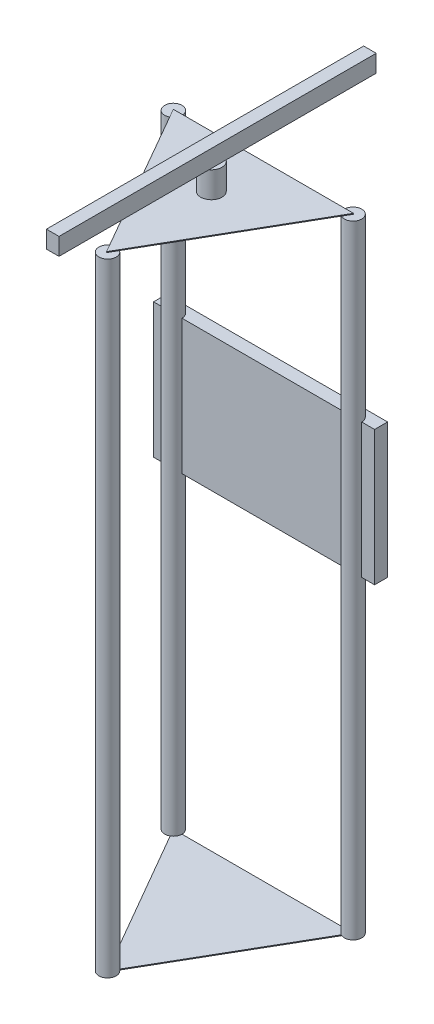
from build123d import *

# Parameters (mm, degrees)
BOSS_EXTRUDE1_DEPTH = 2.54
SKETCH2_R           = 25.4
BOSS_EXTRUDE2_DEPTH = 1828.8
BOSS_EXTRUDE3_DEPTH = 2.54
SKETCH4_R           = 31.109831221
BOSS_EXTRUDE5_DEPTH = 76.2
SKETCH5_W           = 36.901431936
SKETCH5_H           = 931.81733007
BOSS_EXTRUDE7_DEPTH = 50.8
BOSS_EXTRUDE8_DEPTH = 38.1


with BuildPart() as part:
    # Sketch1 → Boss-Extrude1 (new body)
    with BuildSketch(Plane(origin=(0, 0, 0), x_dir=(1, 0, 0), z_dir=(0, 1, 0))):
        Polygon((0, -304.8), (263.964543074, 152.4), (-263.964543074, 152.4), align=None)
    extrude(amount=BOSS_EXTRUDE1_DEPTH)

    # Sketch2 → Boss-Extrude2 (add)
    with BuildSketch(Plane(origin=(0, 2.54, 0), x_dir=(1, 0, 0), z_dir=(0, 1, 0))):
        with Locations(Location((0, -304.8, 0), (0, 0, 120))):
            Circle(SKETCH2_R)
        with Locations((-263.964543074, 152.4)):
            Circle(SKETCH2_R)
        with Locations(Location((263.964543074, 152.4, 0), (0, 0, 180))):
            Circle(SKETCH2_R)
    extrude(amount=BOSS_EXTRUDE2_DEPTH)

    # Sketch3 → Boss-Extrude3 (add)
    with BuildSketch(Plane(origin=(0, 1831.34, 0), x_dir=(1, 0, 0), z_dir=(0, 1, 0))):
        Polygon((-263.964543074, 152.4), (0, -307.726008903), (265.059219048, 152.4), align=None)
    extrude(amount=BOSS_EXTRUDE3_DEPTH)

    # Sketch4 → Boss-Extrude5 (add)
    with BuildSketch(Plane(origin=(0, 1833.88, 0), x_dir=(1, 0, 0), z_dir=(0, 1, 0))):
        with Locations(Location((0, 0, 0), (0, 0, 90))):
            Circle(SKETCH4_R)
    extrude(amount=BOSS_EXTRUDE5_DEPTH)

    # Sketch5 → Boss-Extrude7 (add)
    with BuildSketch(Plane(origin=(0, 1910.08, 0), x_dir=(1, 0, 0), z_dir=(0, 1, 0))):
        Rectangle(SKETCH5_W, SKETCH5_H)
    extrude(amount=BOSS_EXTRUDE7_DEPTH)

    # 3DSketch1 → Boss-Extrude8 (add)
    with BuildSketch(Plane(origin=(327.254814747, 1315.114471395, -152.4), x_dir=(-0.8541064020391608, -0.5200983118562486, 0), z_dir=(0, 0, 1))):
        Polygon((0, 0), (554.560573308, -337.693310003), (760.195046997, 0), (205.634473689, 337.693310003), align=None)
    extrude(amount=-BOSS_EXTRUDE8_DEPTH)


solid = part.part
